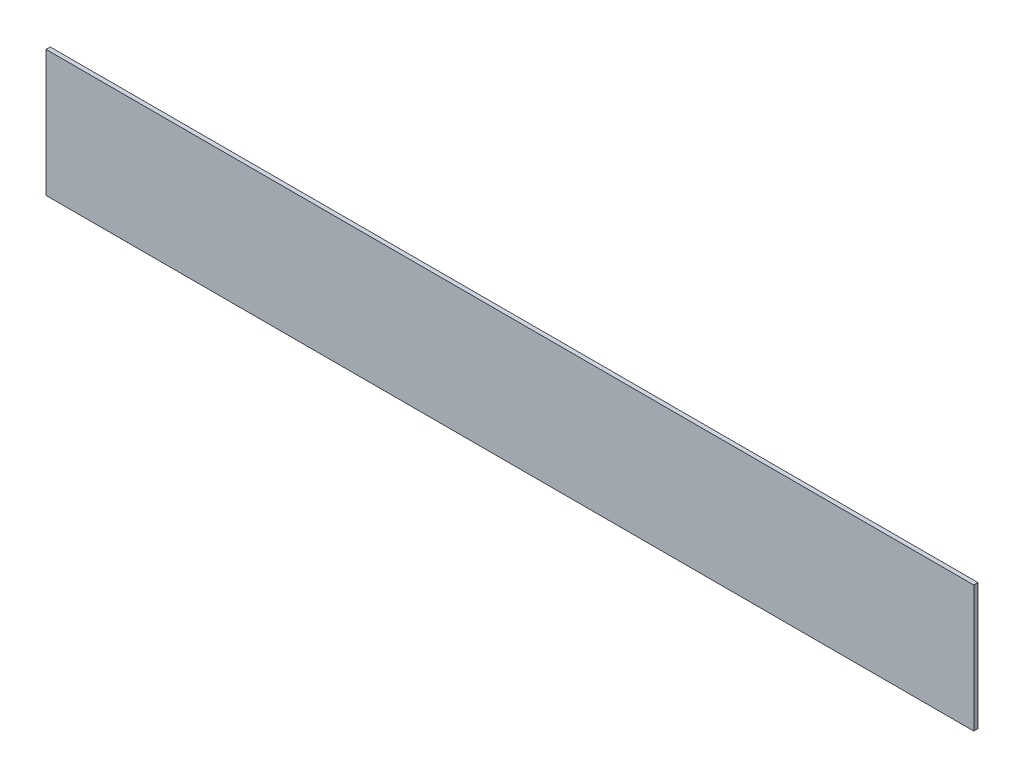
from build123d import *

# Parameters (mm, degrees)
SKETCH1_W           = 558.8
SKETCH1_H           = 76.2
BOSS_EXTRUDE1_DEPTH = 2.54


with BuildPart() as part:
    # Sketch1 → Boss-Extrude1 (new body)
    with BuildSketch(Plane.XY):
        with Locations((279.4, 38.1)):
            Rectangle(SKETCH1_W, SKETCH1_H)
    extrude(amount=BOSS_EXTRUDE1_DEPTH)


solid = part.part
